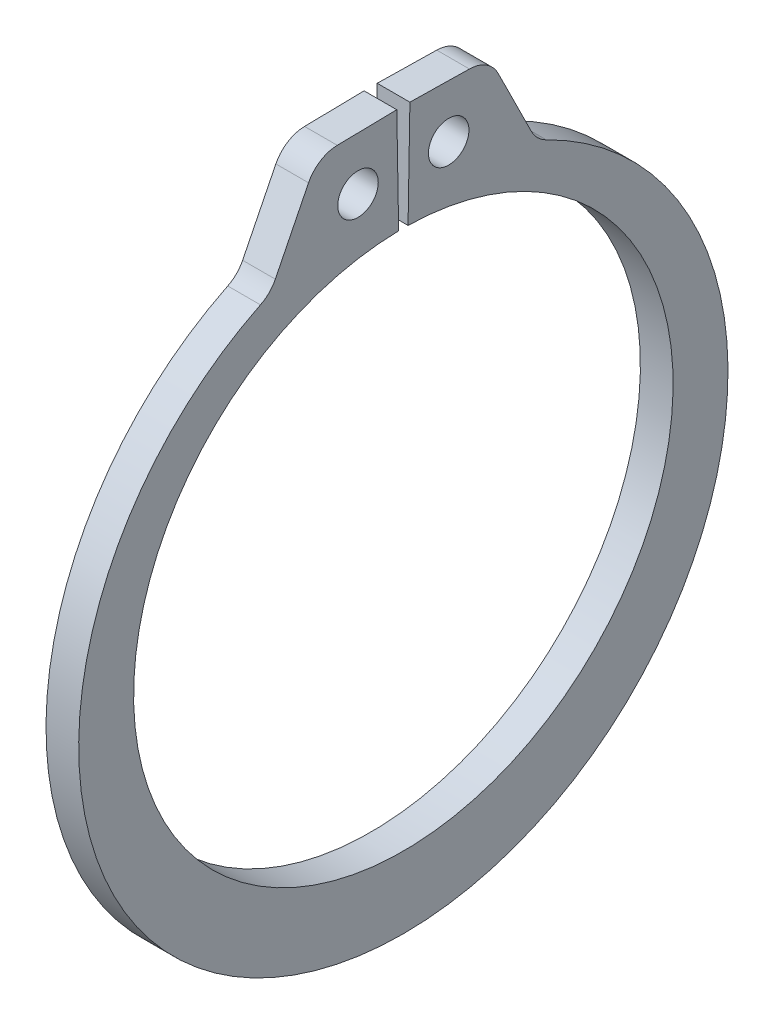
from build123d import *

# Parameters (mm, degrees)
SKETCH1_R      = 0.6604
EXTRUDE1_DEPTH = 0.5334
FILLET1_R      = 1.0668


with BuildPart() as part:
    # Sketch1 → Extrude1 (new, symmetric)
    with BuildSketch(Plane(origin=(0, 0, 0), x_dir=(0, 0, -1), z_dir=(1, 0, 0))):
        with BuildLine():
            Line((-0.153600374, 8.79975955), (-0.213887967, 12.253633428))
            Line((-0.213887967, 12.253633428), (-2.804293376, 12.208417733))
            Line((-2.804293376, 12.208417733), (-4.342027289, 9.115158324))
            ThreePointArc((-4.342027289, 9.115158324), (0, -11.1379), (4.342027289, 9.115158324))
            Line((4.342027289, 9.115158324), (2.804293376, 12.208417733))
            Line((2.804293376, 12.208417733), (0.213887967, 12.253633428))
            Line((0.213887967, 12.253633428), (0.153600374, 8.79975955))
            ThreePointArc((0.153600374, 8.79975955), (0, -8.8011), (-0.153600374, 8.79975955))
        make_face()
        with Locations((-1.478946875, 10.504088642)):
            Circle(SKETCH1_R, mode=Mode.SUBTRACT)
        with Locations((1.478946875, 10.504088642)):
            Circle(SKETCH1_R, mode=Mode.SUBTRACT)
    extrude(amount=EXTRUDE1_DEPTH, both=True)

    # Fillet1
    fillet1_edges = [part.edges().sort_by_distance(p)[0] for p in [
        (0, 12.208417733, -2.804293376),
        (0, 9.115158324, -4.342027289),
        (0, 9.115158324, 4.342027289),
        (0, 12.208417733, 2.804293376),
    ]]
    fillet(fillet1_edges, radius=FILLET1_R)


solid = part.part
